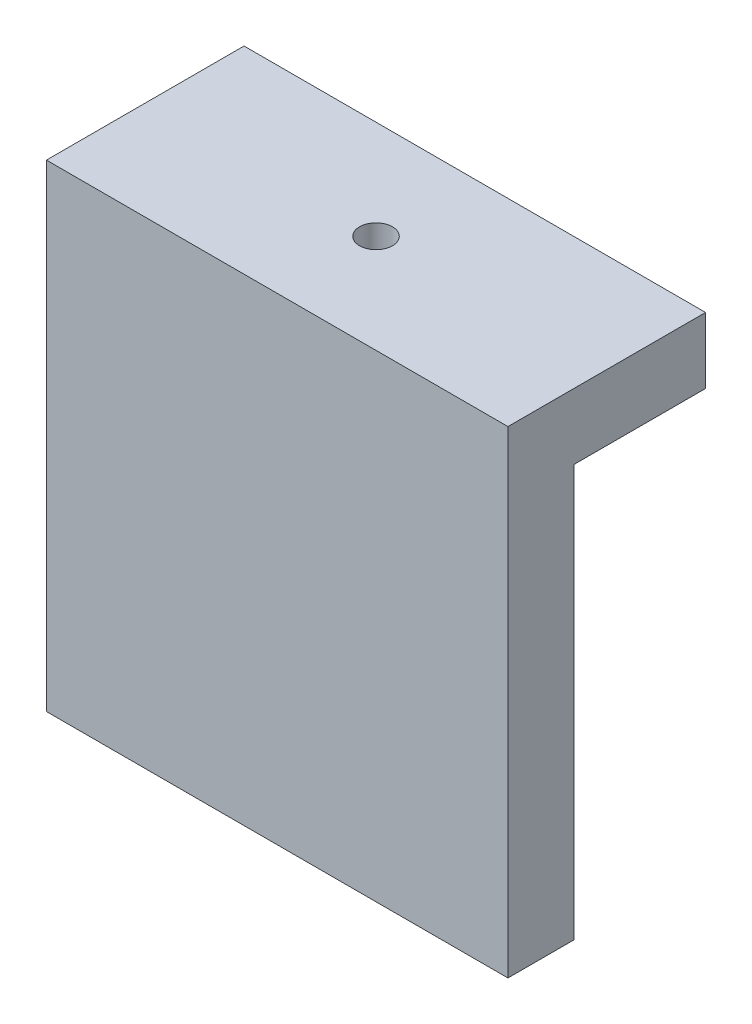
from build123d import *

# Parameters (mm, degrees)
SKETCH1_W           = 40.05
SKETCH1_H           = 50
BOSS_EXTRUDE1_DEPTH = 4
SKETCH2_W           = 24
SKETCH2_H           = 58
BOSS_EXTRUDE2_DEPTH = 8
SKETCH4_W           = 24
SKETCH4_H           = 58
BOSS_EXTRUDE3_DEPTH = 8
BOSS_EXTRUDE5_DEPTH = 40.05
SKETCH6_W           = 32.05
SKETCH6_H           = 50
CUT_EXTRUDE1_DEPTH  = 8
SKETCH7_R           = 2
CUT_EXTRUDE2_DEPTH  = 8
SKETCH9_R           = 2
CUT_EXTRUDE3_DEPTH  = 50
SKETCH11_W          = 16
SKETCH11_H          = 50
CUT_EXTRUDE4_DEPTH  = 80


with BuildPart() as part:
    # Sketch1 → Boss-Extrude1 (new, symmetric)
    with BuildSketch(Plane.XY):
        Rectangle(SKETCH1_W, SKETCH1_H)
    extrude(amount=BOSS_EXTRUDE1_DEPTH, both=True)

    # Sketch2 → Boss-Extrude2 (add)
    with BuildSketch(Plane(origin=(20.025, 0, 0), x_dir=(0, 0, -1), z_dir=(1, 0, 0))):
        with Locations((8, 4)):
            Rectangle(SKETCH2_W, SKETCH2_H)
    extrude(amount=BOSS_EXTRUDE2_DEPTH)

    # Sketch4 → Boss-Extrude3 (add)
    with BuildSketch(Plane.ZY.offset(20.025)):
        with Locations((-8, 4)):
            Rectangle(SKETCH4_W, SKETCH4_H)
    extrude(amount=BOSS_EXTRUDE3_DEPTH)

    # Sketch5 → Boss-Extrude5 (add)
    with BuildSketch(Plane.ZY.offset(-20.025)):
        Polygon((-20, -25), (-20, 33), (4, 33), (4, 25), (-12.05, 25), (-12.05, -25), align=None)
    extrude(amount=BOSS_EXTRUDE5_DEPTH)

    # Sketch6 → Cut-Extrude1 (cut)
    with BuildSketch(Plane(origin=(0, 0, -20), x_dir=(-1, 0, 0), z_dir=(0, 0, -1))):
        Rectangle(SKETCH6_W, SKETCH6_H)
    extrude(amount=-CUT_EXTRUDE1_DEPTH, mode=Mode.SUBTRACT)

    # Sketch7 → Cut-Extrude2 (cut)
    with BuildSketch(Plane(origin=(0, 33, 0), x_dir=(1, 0, 0), z_dir=(0, 1, 0))):
        with Locations(Location((0, 8, 0), (0, 0, 270))):
            Circle(SKETCH7_R)
    extrude(amount=-CUT_EXTRUDE2_DEPTH, mode=Mode.SUBTRACT)

    # Sketch9 → Cut-Extrude3 (cut, symmetric)
    with BuildSketch(Plane.ZY.offset(-20.025)):
        with Locations((-8.025, 0)):
            Circle(SKETCH9_R)
    extrude(amount=CUT_EXTRUDE3_DEPTH, both=True, mode=Mode.SUBTRACT)

    # Sketch11 → Cut-Extrude4 (cut)
    with BuildSketch(Plane(origin=(28.025, 0, 0), x_dir=(0, 0, -1), z_dir=(1, 0, 0))):
        with Locations((12, 0)):
            Rectangle(SKETCH11_W, SKETCH11_H)
    extrude(amount=-CUT_EXTRUDE4_DEPTH, mode=Mode.SUBTRACT)


solid = part.part
